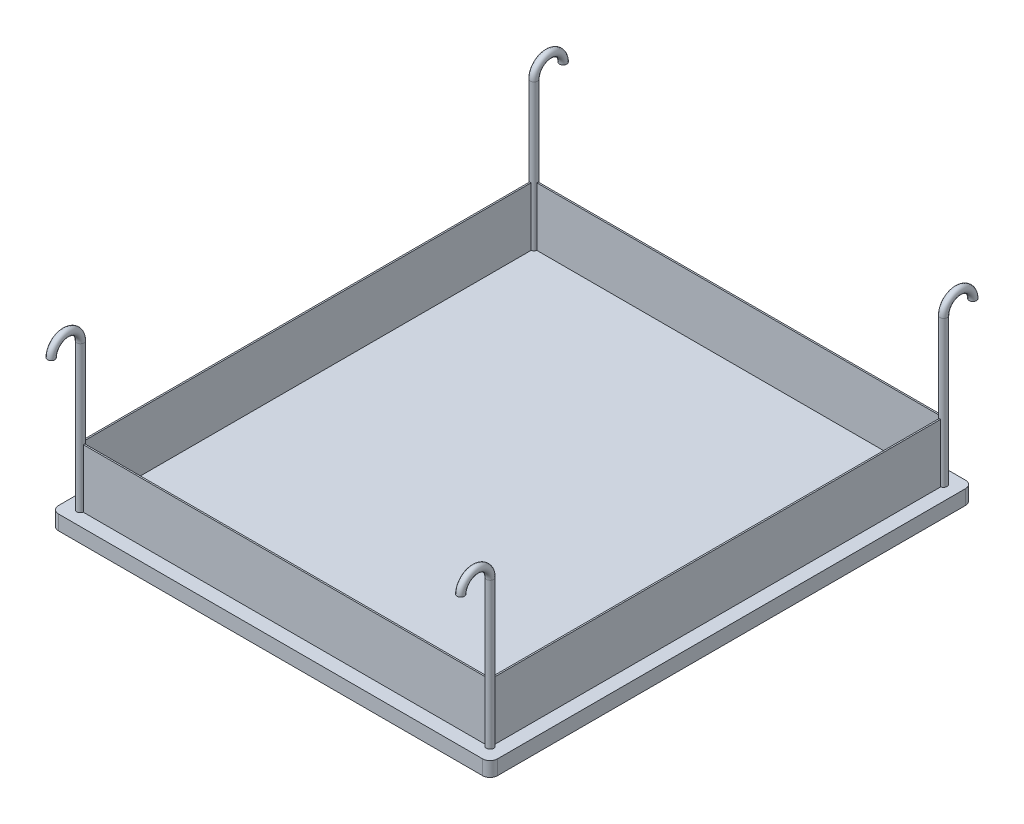
from build123d import *

# Parameters (mm, degrees)
SKETCH1_W            = 300
SKETCH1_H            = 165
BOSS_EXTRUDE1_DEPTH  = 10
SKETCH2_R            = 2.5
FILLET1_R            = 5
EXTRUDE_THIN1_DEPTH  = 40
FILLET1_OF_MIRROR1_R = 5


with BuildPart() as part:
    # Sketch1 → Boss-Extrude1 (new body)
    with BuildSketch(Plane(origin=(0, 0, 0), x_dir=(1, 0, 0), z_dir=(0, 1, 0))):
        with Locations((0, -82.5)):
            Rectangle(SKETCH1_W, SKETCH1_H)
    boss_extrude1 = extrude(amount=BOSS_EXTRUDE1_DEPTH)

    # Sweep1: sweep along a path in Sketch3
    with BuildLine(Plane(origin=(0, 0, 0), x_dir=(0, 0, -1), z_dir=(1, 0, 0))) as sweep1_path:
        Line((-155, 10), (-155, 110))
        ThreePointArc((-155, 110), (-165, 120), (-175, 110))
    # Sketch2 → Sweep1 (sweep)
    with BuildSketch(Plane(origin=(0, 10, 0), x_dir=(1, 0, 0), z_dir=(0, 1, 0))):
        with Locations((-140, -155)):
            Circle(SKETCH2_R)
        with Locations((140, -155)):
            Circle(SKETCH2_R)
    sweep1 = sweep(path=sweep1_path.line)

    # Fillet1
    fillet1_edges = [part.edges().sort_by_distance(p)[0] for p in [
        (150, 5, 165),
        (-150, 5, 165),
    ]]
    fillet(fillet1_edges, radius=FILLET1_R)

    # Sketch4 → Extrude-Thin1 (add)
    with BuildSketch(Plane(origin=(0, 10, 0), x_dir=(1, 0, 0), z_dir=(0, 1, 0))):
        Polygon((-140.5, 0), (-140.5, -155.5), (140.5, -155.5), (140.5, 0), (139.5, 0), (139.5, -154.5), (-139.5, -154.5), (-139.5, 0), align=None)
    extrude_thin1 = extrude(amount=EXTRUDE_THIN1_DEPTH)

    # Mirror1: Boss-Extrude1, Sweep1, Extrude-Thin1 across plane
    add(boss_extrude1.mirror(Plane(origin=(-150, 10, 0), x_dir=(1, 0, 0), z_dir=(0, 0, 1))))
    add(sweep1.mirror(Plane(origin=(-150, 10, 0), x_dir=(1, 0, 0), z_dir=(0, 0, 1))))
    add(extrude_thin1.mirror(Plane(origin=(-150, 10, 0), x_dir=(1, 0, 0), z_dir=(0, 0, 1))))

    # Fillet1 of Mirror1
    fillet1_of_mirror1_edges = [part.edges().sort_by_distance(p)[0] for p in [
        (150, 5, -165),
        (-150, 5, -165),
    ]]
    fillet(fillet1_of_mirror1_edges, radius=FILLET1_OF_MIRROR1_R)


solid = part.part
